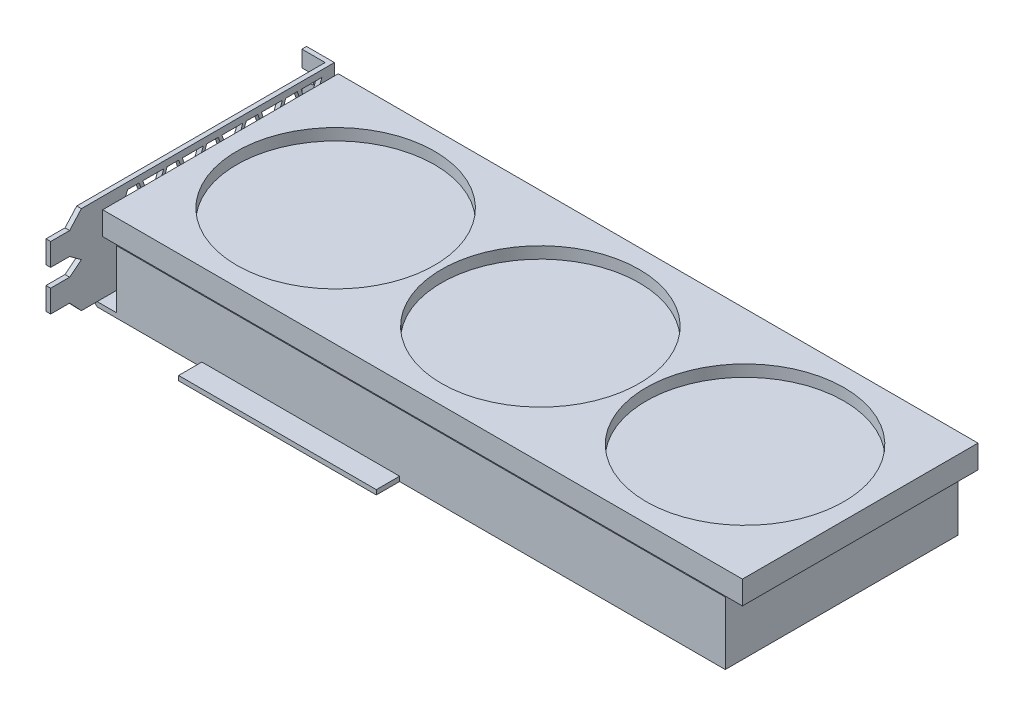
from build123d import *

# Parameters (mm, degrees)
BOSS_EXTRUDE3_DEPTH  = 2
BOSS_EXTRUDE4_DEPTH  = 2
BOSS_EXTRUDE5_DEPTH  = 2
SKETCH8_W            = 261.713534547
SKETCH8_H            = 100
BOSS_EXTRUDE6_DEPTH  = 25
SKETCH10_W           = 275
SKETCH10_H           = 101.274764681
BOSS_EXTRUDE12_DEPTH = 10
SKETCH11_R           = 42.5
CUT_EXTRUDE1_DEPTH   = 5
BOSS_EXTRUDE13_DEPTH = 100


with BuildPart() as part:
    # Sketch5 → Boss-Extrude3 (new body)
    with BuildSketch(Plane(origin=(0, 0, 0), x_dir=(1, 0, 0), z_dir=(0, 1, 0))):
        Polygon((-103.880167522, -0.376107035), (-58.880167522, -0.376107035), (-58.880167522, -10.376107035), (26.119832478, -10.376107035), (26.119832478, -0.376107035), (166.119832478, -0.376107035), (166.119832478, 99.623892965), (-103.880167522, 99.623892965), align=None)
    extrude(amount=BOSS_EXTRUDE3_DEPTH)

    # Sketch8 → Boss-Extrude6 (add)
    with BuildSketch(Plane(origin=(0, 2, 0), x_dir=(1, 0, 0), z_dir=(0, 1, 0))):
        with Locations((35.263065205, 49.623892965)):
            Rectangle(SKETCH8_W, SKETCH8_H)
    extrude(amount=BOSS_EXTRUDE6_DEPTH)

    # Sketch10 → Boss-Extrude12 (add)
    with BuildSketch(Plane(origin=(0, 27, 0), x_dir=(1, 0, 0), z_dir=(0, 1, 0))):
        with Locations((35.619832478, 50.637382341)):
            Rectangle(SKETCH10_W, SKETCH10_H)
    extrude(amount=BOSS_EXTRUDE12_DEPTH)

    # Sketch11 → Cut-Extrude1 (cut)
    with BuildSketch(Plane(origin=(0, 37, 0), x_dir=(1, 0, 0), z_dir=(0, 1, 0))):
        with Locations(Location((-52.380167522, 50.637382341, 0), (0, 0, 270))):
            Circle(SKETCH11_R)
        with Locations(Location((35.619832478, 50.637382341, 0), (0, 0, 270))):
            Circle(SKETCH11_R)
        with Locations(Location((123.619832478, 50.637382341, 0), (0, 0, 270))):
            Circle(SKETCH11_R)
    extrude(amount=-CUT_EXTRUDE1_DEPTH, mode=Mode.SUBTRACT)



with BuildPart() as body_2:
    # Sketch6 → Boss-Extrude4 (new body)
    with BuildSketch(Plane.ZY.offset(103.880167522)):
        Polygon((20.376107035, 24.715693455), (20.376107035, 34.376362412), (12.211753174, 34.376362412), (7.158636381, 40), (-99.623892965, 40), (-99.623892965, 2), (7.158636381, 2), (12.211753174, 7.347361164), (20.376107035, 7.347361164), (20.376107035, 17.00803012), (12.211753174, 17.00803012), (7.158636381, 21), (12.211753174, 24.715693455), align=None)
        Polygon((-96.224369695, 37.167846263), (-87.224369695, 37.167846263), (-89.243484095, 31.629648909), (-94.205255294, 31.629648909), align=None, mode=Mode.SUBTRACT)
        Polygon((-94.205255294, 30.142776983), (-89.243484095, 30.142776983), (-87.224369695, 24.604579628), (-96.224369695, 24.604579628), align=None, mode=Mode.SUBTRACT)
        Polygon((-87.676784041, 31.618589654), (-85.65766964, 37.156787008), (-80.695898442, 37.156787008), (-78.676784041, 31.618589654), align=None, mode=Mode.SUBTRACT)
        Polygon((-87.706864453, 30.142776983), (-78.706864453, 30.142776983), (-80.725978853, 24.604579628), (-85.687750052, 24.604579628), align=None, mode=Mode.SUBTRACT)
        Polygon((-77.205255294, 31.629648909), (-79.224369695, 37.167846263), (-70.224369695, 37.167846263), (-72.243484095, 31.629648909), align=None, mode=Mode.SUBTRACT)
        Polygon((-61.676784041, 31.618589654), (-70.676784041, 31.618589654), (-68.65766964, 37.156787008), (-63.695898442, 37.156787008), align=None, mode=Mode.SUBTRACT)
        Polygon((-68.687750052, 24.604579628), (-70.706864453, 30.142776983), (-61.706864453, 30.142776983), (-63.725978853, 24.604579628), align=None, mode=Mode.SUBTRACT)
        Polygon((-79.224369695, 24.604579628), (-77.205255294, 30.142776983), (-72.243484095, 30.142776983), (-70.224369695, 24.604579628), align=None, mode=Mode.SUBTRACT)
        Polygon((-60.205255294, 31.629648909), (-62.224369695, 37.167846263), (-53.224369695, 37.167846263), (-55.243484095, 31.629648909), align=None, mode=Mode.SUBTRACT)
        Polygon((-44.676784041, 31.618589654), (-53.676784041, 31.618589654), (-51.65766964, 37.156787008), (-46.695898442, 37.156787008), align=None, mode=Mode.SUBTRACT)
        Polygon((-51.687750052, 24.604579628), (-53.706864453, 30.142776983), (-44.706864453, 30.142776983), (-46.725978853, 24.604579628), align=None, mode=Mode.SUBTRACT)
        Polygon((-62.224369695, 24.604579628), (-60.205255294, 30.142776983), (-55.243484095, 30.142776983), (-53.224369695, 24.604579628), align=None, mode=Mode.SUBTRACT)
        Polygon((-43.205255294, 31.629648909), (-45.224369695, 37.167846263), (-36.224369695, 37.167846263), (-38.243484095, 31.629648909), align=None, mode=Mode.SUBTRACT)
        Polygon((-27.676784041, 31.618589654), (-36.676784041, 31.618589654), (-34.65766964, 37.156787008), (-29.695898442, 37.156787008), align=None, mode=Mode.SUBTRACT)
        Polygon((-34.687750052, 24.604579628), (-36.706864453, 30.142776983), (-27.706864453, 30.142776983), (-29.725978853, 24.604579628), align=None, mode=Mode.SUBTRACT)
        Polygon((-45.224369695, 24.604579628), (-43.205255294, 30.142776983), (-38.243484095, 30.142776983), (-36.224369695, 24.604579628), align=None, mode=Mode.SUBTRACT)
        Polygon((-26.205255294, 31.629648909), (-28.224369695, 37.167846263), (-19.224369695, 37.167846263), (-21.243484095, 31.629648909), align=None, mode=Mode.SUBTRACT)
        Polygon((-10.676784041, 31.618589654), (-19.676784041, 31.618589654), (-17.65766964, 37.156787008), (-12.695898442, 37.156787008), align=None, mode=Mode.SUBTRACT)
        Polygon((-17.687750052, 24.604579628), (-19.706864453, 30.142776983), (-10.706864453, 30.142776983), (-12.725978853, 24.604579628), align=None, mode=Mode.SUBTRACT)
        Polygon((-28.224369695, 24.604579628), (-26.205255294, 30.142776983), (-21.243484095, 30.142776983), (-19.224369695, 24.604579628), align=None, mode=Mode.SUBTRACT)
        Polygon((-77.205255294, 17.629648909), (-79.224369695, 23.167846263), (-70.224369695, 23.167846263), (-72.243484095, 17.629648909), align=None, mode=Mode.SUBTRACT)
        Polygon((-61.676784041, 17.618589654), (-70.676784041, 17.618589654), (-68.65766964, 23.156787008), (-63.695898442, 23.156787008), align=None, mode=Mode.SUBTRACT)
        Polygon((-68.687750052, 10.604579628), (-70.706864453, 16.142776983), (-61.706864453, 16.142776983), (-63.725978853, 10.604579628), align=None, mode=Mode.SUBTRACT)
        Polygon((-79.224369695, 10.604579628), (-77.205255294, 16.142776983), (-72.243484095, 16.142776983), (-70.224369695, 10.604579628), align=None, mode=Mode.SUBTRACT)
        Polygon((-60.205255294, 17.629648909), (-62.224369695, 23.167846263), (-53.224369695, 23.167846263), (-55.243484095, 17.629648909), align=None, mode=Mode.SUBTRACT)
        Polygon((-44.676784041, 17.618589654), (-53.676784041, 17.618589654), (-51.65766964, 23.156787008), (-46.695898442, 23.156787008), align=None, mode=Mode.SUBTRACT)
        Polygon((-51.687750052, 10.604579628), (-53.706864453, 16.142776983), (-44.706864453, 16.142776983), (-46.725978853, 10.604579628), align=None, mode=Mode.SUBTRACT)
        Polygon((-62.224369695, 10.604579628), (-60.205255294, 16.142776983), (-55.243484095, 16.142776983), (-53.224369695, 10.604579628), align=None, mode=Mode.SUBTRACT)
        Polygon((-43.205255294, 17.629648909), (-45.224369695, 23.167846263), (-36.224369695, 23.167846263), (-38.243484095, 17.629648909), align=None, mode=Mode.SUBTRACT)
        Polygon((-27.676784041, 17.618589654), (-36.676784041, 17.618589654), (-34.65766964, 23.156787008), (-29.695898442, 23.156787008), align=None, mode=Mode.SUBTRACT)
        Polygon((-34.687750052, 10.604579628), (-36.706864453, 16.142776983), (-27.706864453, 16.142776983), (-29.725978853, 10.604579628), align=None, mode=Mode.SUBTRACT)
        Polygon((-45.224369695, 10.604579628), (-43.205255294, 16.142776983), (-38.243484095, 16.142776983), (-36.224369695, 10.604579628), align=None, mode=Mode.SUBTRACT)
        Polygon((-26.205255294, 17.629648909), (-28.224369695, 23.167846263), (-19.224369695, 23.167846263), (-21.243484095, 17.629648909), align=None, mode=Mode.SUBTRACT)
        Polygon((-10.676784041, 17.618589654), (-19.676784041, 17.618589654), (-17.65766964, 23.156787008), (-12.695898442, 23.156787008), align=None, mode=Mode.SUBTRACT)
        Polygon((-17.687750052, 10.604579628), (-19.706864453, 16.142776983), (-10.706864453, 16.142776983), (-12.725978853, 10.604579628), align=None, mode=Mode.SUBTRACT)
        Polygon((-28.224369695, 10.604579628), (-26.205255294, 16.142776983), (-21.243484095, 16.142776983), (-19.224369695, 10.604579628), align=None, mode=Mode.SUBTRACT)
        Polygon((-94.205255294, 17.629648909), (-96.224369695, 23.167846263), (-87.224369695, 23.167846263), (-89.243484095, 17.629648909), align=None, mode=Mode.SUBTRACT)
        Polygon((-78.676784041, 17.618589654), (-87.676784041, 17.618589654), (-85.65766964, 23.156787008), (-80.695898442, 23.156787008), align=None, mode=Mode.SUBTRACT)
        Polygon((-85.687750052, 10.604579628), (-87.706864453, 16.142776983), (-78.706864453, 16.142776983), (-80.725978853, 10.604579628), align=None, mode=Mode.SUBTRACT)
        Polygon((-96.224369695, 10.604579628), (-94.205255294, 16.142776983), (-89.243484095, 16.142776983), (-87.224369695, 10.604579628), align=None, mode=Mode.SUBTRACT)
    extrude(amount=BOSS_EXTRUDE4_DEPTH)

    # Sketch7 → Boss-Extrude5 (add)
    with BuildSketch(Plane(origin=(0, 0, -99.623892965), x_dir=(-1, 0, 0), z_dir=(0, 0, -1))):
        Polygon((115.880167522, 6), (115.880167522, 1), (110.880167522, 1), (110.880167522, 6), (103.880167522, 6), (103.880167522, 40), (115.880167522, 40), (115.880167522, 33), (110.880167522, 33), (110.880167522, 29), (115.880167522, 29), (115.880167522, 15), (110.880167522, 15), (110.880167522, 11), (115.880167522, 11), align=None)
        with BuildLine():
            Line((110.28164568, 25.052655869), (110.28164568, 20.947344131))
            ThreePointArc((110.28164568, 20.947344131), (108.880167522, 19.545865973), (107.478689364, 20.947344131))
            Line((107.478689364, 20.947344131), (107.478689364, 25.052655869))
            ThreePointArc((107.478689364, 25.052655869), (108.880167522, 26.454134027), (110.28164568, 25.052655869))
        make_face(mode=Mode.SUBTRACT)
    extrude(amount=BOSS_EXTRUDE5_DEPTH)


with BuildPart() as part_1:
    add(part.part)

    add(body_2.part)  # Boss-Extrude13 merges body 2
    # Sketch12 → Boss-Extrude13 (add)
    with BuildSketch(Plane(origin=(0, 0, -99.623892965), x_dir=(-1, 0, 0), z_dir=(0, 0, -1))):
        Polygon((103.880167522, 2), (105.880167522, 2), (103.880167522, 0), align=None)
    extrude(amount=-BOSS_EXTRUDE13_DEPTH)


solid = part_1.part
